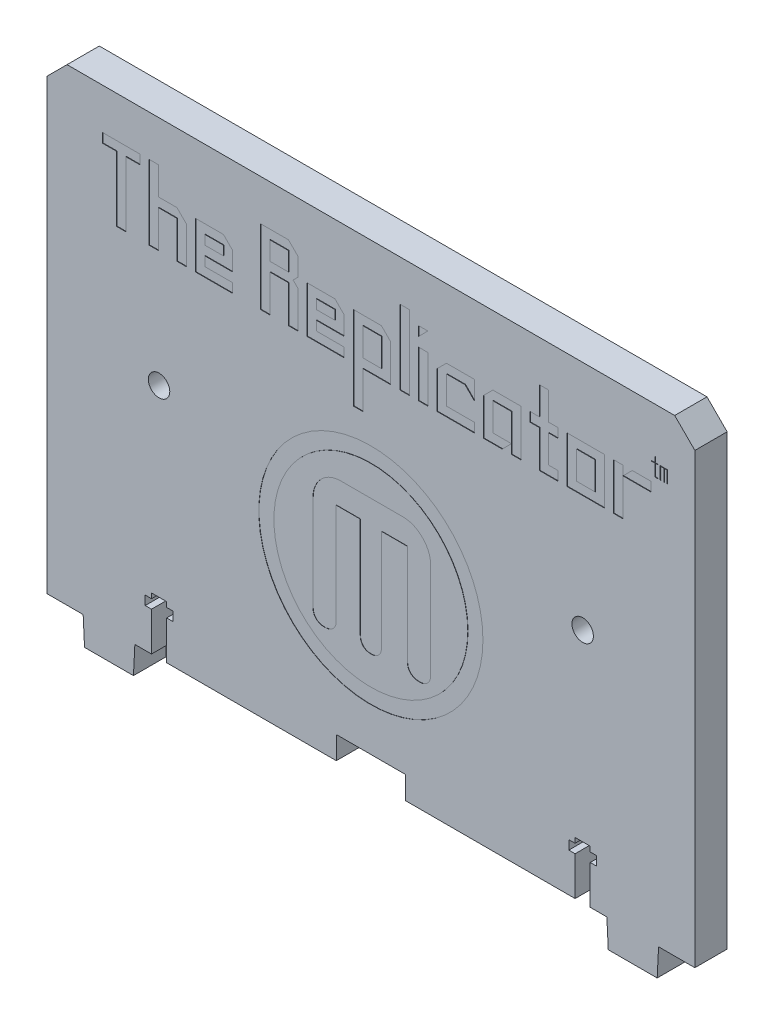
from build123d import *

# Parameters (mm, degrees)
SKETCH1_R           = 2.125
BOSS_EXTRUDE1_DEPTH = 6.4
SKETCH2_R           = 22.22577486
SKETCH2_R_2         = 19.22577486
CUT_EXTRUDE1_DEPTH  = 0.05
SKETCH3_W           = 3.685081967
SKETCH3_H           = 3.685081967
SKETCH3_W_2         = 1.842540983
SKETCH3_H_2         = 14.740327869
SKETCH3_H_3         = 9.212704918
SKETCH3_H_4         = 1.842540983
CUT_EXTRUDE5_DEPTH  = 0.1


with BuildPart() as part:
    # Sketch1 → Boss-Extrude1 (new body)
    with BuildSketch(Plane.XY):
        Polygon((-37.233636091, 42.215289676), (-37.233636091, -46.624716164), (-30.033636091, -46.624716164), (-29.758636091, -52.124716164), (-20.058636091, -52.124716164), (-19.783636091, -46.624716164), (-16.483636091, -46.624716164), (-16.483636091, -38.924710324), (-17.733636091, -38.924710324), (-17.733636091, -37.124710324), (-16.483636091, -37.124710324), (-16.483636091, -36.124710324), (-13.482276918, -36.124710324), (-13.482276918, -37.124710324), (-12.233636091, -37.124710324), (-12.233636091, -38.924710324), (-13.482276918, -38.924710324), (-13.482276918, -46.624716164), (20.166363909, -46.624716164), (20.166363909, -42.124716164), (33.866363909, -42.124716164), (33.866363909, -46.624716164), (67.515004735, -46.624716164), (67.515004735, -38.924716164), (66.266363909, -38.924716164), (66.266363909, -37.124716164), (67.515004735, -37.124716164), (67.515004735, -36.124716164), (70.516363909, -36.124716164), (70.516363909, -37.124716164), (71.766363909, -37.124716164), (71.766363909, -38.924716164), (70.516363909, -38.924716164), (70.516363909, -46.624716164), (73.816363909, -46.624716164), (74.091363909, -52.124716164), (83.791363909, -52.124716164), (84.066363909, -46.624716164), (91.266363909, -46.624716164), (91.266363909, 42.215289676), (87.266363909, 46.215289676), (-33.233636091, 46.215289676), align=None)
        with Locations((-14.982956505, 0.241643009)):
            Circle(SKETCH1_R, mode=Mode.SUBTRACT)
        with Locations(Location((69.015684322, 0.241643009, 0), (0, 0, 180))):
            Circle(SKETCH1_R, mode=Mode.SUBTRACT)
    extrude(amount=BOSS_EXTRUDE1_DEPTH)

    # Sketch2 → Cut-Extrude1 (cut)
    # profile 1 of 2: a face of its own
    with BuildSketch(Plane.XY.offset(6.4)):
        with Locations((27.013633167, -11.34725639)):
            Circle(SKETCH2_R)
        with Locations((27.013633167, -11.34725639)):
            Circle(SKETCH2_R_2, mode=Mode.SUBTRACT)
    # profile 2 of 2: a face of its own
    with BuildSketch(Plane.XY.offset(6.4)):
        with BuildLine():
            add(Edge.make_bspline(
                [(24.898597269, -22.599993337), (24.912618116, -22.893168372), (24.930798797, -23.188850856), (25.058219598, -23.606402367), (25.117244847, -23.742605904), (25.258610979, -23.997579784), (25.339711393, -24.118352097), (25.631970927, -24.449112376), (25.884659311, -24.61566059), (26.292865327, -24.770033333), (26.436296205, -24.805382018), (26.727468183, -24.844445565), (26.874272418, -24.850576033), (27.021065498, -24.856829202)],
                knots=[0, 0, 0, 0, 0.25, 0.25, 0.375, 0.375, 0.5, 0.5, 0.75, 0.75, 0.875, 0.875, 1, 1, 1, 1], degree=3))
            add(Edge.make_bspline(
                [(27.021065498, -24.856829202), (27.167969367, -24.850601654), (27.314884577, -24.844518355), (27.606580479, -24.805202296), (27.748626116, -24.769897293), (28.157512678, -24.616069014), (28.404680045, -24.446385281), (28.796431058, -24.00802027), (28.94102868, -23.746397751), (29.068268786, -23.329035533), (29.096467545, -23.183826386), (29.129610604, -22.8928638), (29.136461267, -22.746450594), (29.143430302, -22.600048736)],
                knots=[0, 0, 0, 0, 0.125, 0.125, 0.25, 0.25, 0.5, 0.5, 0.75, 0.75, 0.875, 0.875, 1, 1, 1, 1], degree=3))
            Line((29.143430302, -22.600048736), (29.143430302, -2.754053281))
            Line((29.143430302, -2.754053281), (34.264370542, -2.754053281))
            Line((34.264370542, -2.754053281), (34.264370542, -22.603127029))
            add(Edge.make_bspline(
                [(34.264370542, -22.603127029), (34.269826179, -22.757824895), (34.274576076, -22.912998736), (34.318748855, -23.219270225), (34.361248068, -23.366112195), (34.471110792, -23.652129862), (34.538368921, -23.792611975), (34.706173271, -24.046134872), (34.80740239, -24.161157336), (35.147452885, -24.474358508), (35.41769511, -24.633152257), (35.85175989, -24.775627316), (36.003428928, -24.807909013), (36.308380971, -24.844166273), (36.461941889, -24.85050425), (36.615500426, -24.856868116)],
                knots=[0, 0, 0, 0, 0.125, 0.125, 0.25, 0.25, 0.375, 0.375, 0.5, 0.5, 0.75, 0.75, 0.875, 0.875, 1, 1, 1, 1], degree=3))
            add(Edge.make_bspline(
                [(36.615500426, -24.856868116), (36.767002946, -24.850843697), (36.918879842, -24.844941869), (37.219259792, -24.805414421), (37.364771423, -24.769779987), (37.646326666, -24.666392037), (37.78338066, -24.597684993), (38.034751242, -24.434251669), (38.150667914, -24.339095246), (38.470878959, -24.015737597), (38.632804631, -23.753825812), (38.790500191, -23.332794914), (38.830475393, -23.18571394), (38.872361291, -22.886518645), (38.877821697, -22.735448747), (38.883834506, -22.584431377)],
                knots=[0, 0, 0, 0, 0.125, 0.125, 0.25, 0.25, 0.375, 0.375, 0.5, 0.5, 0.75, 0.75, 0.875, 0.875, 1, 1, 1, 1], degree=3))
            Line((38.883834506, -22.584431377), (38.883834506, -3.764709369))
            add(Edge.make_bspline(
                [(38.883834506, -3.764709369), (38.8784273, -3.578216222), (38.873112081, -3.391718501), (38.843883721, -3.019647721), (38.819373478, -2.835335429), (38.717342808, -2.291657346), (38.612899106, -1.939290527), (38.33251923, -1.254352439), (38.156862762, -0.92285707), (37.738406935, -0.318629822), (37.500526055, -0.03658407), (36.976481483, 0.491121906), (36.695028686, 0.73142933), (36.082641378, 1.152083071), (35.755711269, 1.326575091), (35.076571455, 1.603655504), (34.718329616, 1.7068022), (33.988597151, 1.837260408), (33.618652429, 1.854818533), (33.247965607, 1.865410683)],
                knots=[0, 0, 0, 0, 0.0625, 0.0625, 0.125, 0.125, 0.25, 0.25, 0.375, 0.375, 0.5, 0.5, 0.625, 0.625, 0.75, 0.75, 0.875, 0.875, 1, 1, 1, 1], degree=3))
            Line((33.247965607, 1.865410683), (21.168664354, 1.865410683))
            add(Edge.make_bspline(
                [(21.168664354, 1.865410683), (20.982195167, 1.860103743), (20.7957219, 1.854872369), (20.423717657, 1.826960935), (20.238467109, 1.803440831), (19.692779717, 1.705541418), (19.340071125, 1.601847617), (18.655721072, 1.321415046), (18.323535817, 1.146041073), (17.718749966, 0.728262121), (17.43827968, 0.489487275), (16.914407634, -0.038594958), (16.675083117, -0.321964919), (16.252892734, -0.934093757), (16.080968003, -1.261349182), (15.803810946, -1.939923401), (15.697889628, -2.296644836), (15.596130098, -2.842831405), (15.572128391, -3.025972905), (15.543491846, -3.394363443), (15.538192815, -3.579540203), (15.532823996, -3.764709369)],
                knots=[0, 0, 0, 0, 0.0625, 0.0625, 0.125, 0.125, 0.25, 0.25, 0.375, 0.375, 0.5, 0.5, 0.625, 0.625, 0.75, 0.75, 0.875, 0.875, 0.9375, 0.9375, 1, 1, 1, 1], degree=3))
            Line((15.532823996, -3.764709369), (15.532823996, -22.585267145))
            add(Edge.make_bspline(
                [(15.532823996, -22.585267145), (15.538377488, -22.737568508), (15.543410883, -22.890264437), (15.583724013, -23.192214396), (15.622237591, -23.337870248), (15.723938899, -23.622032367), (15.786335088, -23.762198894), (15.942572277, -24.017953727), (16.037607343, -24.134063811), (16.253757105, -24.348134764), (16.371490543, -24.442690553), (16.629843038, -24.602231944), (16.767319564, -24.665770141), (17.050119253, -24.7675129), (17.198162286, -24.805380463), (17.498131816, -24.845471913), (17.649479539, -24.85107548), (17.80080807, -24.856882401)],
                knots=[0, 0, 0, 0, 0.125, 0.125, 0.25, 0.25, 0.375, 0.375, 0.5, 0.5, 0.625, 0.625, 0.75, 0.75, 0.875, 0.875, 1, 1, 1, 1], degree=3))
            add(Edge.make_bspline(
                [(17.80080807, -24.856882401), (17.954548684, -24.850509908), (18.108292359, -24.844170523), (18.413595428, -24.807855837), (18.565469291, -24.775516228), (19.000055914, -24.632666045), (19.270904108, -24.47403323), (19.723827816, -24.054593293), (19.898125997, -23.794182578), (20.060796569, -23.365369448), (20.099001522, -23.217477502), (20.140580944, -22.910921214), (20.146183434, -22.756435974), (20.15228796, -22.602059665)],
                knots=[0, 0, 0, 0, 0.125, 0.125, 0.25, 0.25, 0.5, 0.5, 0.75, 0.75, 0.875, 0.875, 1, 1, 1, 1], degree=3))
            Line((20.15228796, -22.602059665), (20.15228796, -2.754053281))
            Line((20.15228796, -2.754053281), (24.898597269, -2.754053281))
            Line((24.898597269, -2.754053281), (24.898597269, -22.599993337))
        make_face()
    extrude(amount=-CUT_EXTRUDE1_DEPTH, mode=Mode.SUBTRACT)

    # Sketch3 → Cut-Extrude5 (cut)
    # profile 1 of 17: a face of its own
    with BuildSketch(Plane.XY.offset(6.4)):
        Polygon((83.439607863, 36.201077972), (83.439607863, 37.267604529), (83.312167863, 37.267604529), (83.312167863, 36.201077972), (82.715184584, 36.201077972), (82.715184584, 36.073637972), (83.312167863, 36.073637972), (83.312167863, 33.685704857), (83.909151142, 33.685704857), (83.909151142, 33.813144857), (83.439607863, 33.813144857), (83.439607863, 36.073637972), (83.909151142, 36.073637972), (83.909151142, 36.201077972), align=None)
    # profile 2 of 17: a face of its own
    with BuildSketch(Plane.XY.offset(6.4)):
        Polygon((84.37869442, 36.201077972), (84.37869442, 33.685704857), (84.50613442, 33.685704857), (84.50613442, 36.073637972), (85.103117699, 36.073637972), (85.103117699, 33.685704857), (85.230557699, 33.685704857), (85.230557699, 36.073637972), (85.700100978, 36.073637972), (85.700100978, 33.685704857), (85.827540978, 33.685704857), (85.827540978, 36.201077972), (85.103117699, 36.201077972), align=None)
    # profile 3 of 17: a face of its own
    with BuildSketch(Plane.XY.offset(6.4)):
        Polygon((49.372743169, 23.347301361), (53.057825136, 23.347301361), (54.90036612, 25.188127455), (54.90036612, 23.347301361), (56.742907103, 23.347301361), (56.742907103, 30.717465295), (56.742907103, 32.560006279), (51.215284153, 32.560006279), (49.372743169, 30.717465295), (49.372743169, 28.874924312), (49.372743169, 27.032383328), align=None)
        Polygon((52.294619672, 25.189842344), (51.215284153, 25.189842344), (51.215284153, 28.874924312), (51.215284153, 30.717465295), (54.90036612, 30.717465295), (54.90036612, 28.874924312), (54.90036612, 25.189842344), align=None, mode=Mode.SUBTRACT)
    # profile 4 of 17: a face of its own
    with BuildSketch(Plane.XY.offset(6.4)):
        Polygon((82.538480874, 32.560006279), (78.853398907, 32.560006279), (77.010857923, 30.717678105), (82.538480874, 30.717465295), align=None)
    # profile 5 of 17: a face of its own
    with BuildSketch(Plane.XY.offset(6.4)):
        Polygon((77.010857923, 23.347301361), (77.010857923, 30.717678105), (77.010857923, 32.560006279), (75.16831694, 32.560006279), (75.16831694, 23.347301361), align=None)
    # profile 6 of 17: a face of its own
    with BuildSketch(Plane.XY.offset(6.4)):
        Polygon((10.679382513, 38.08762923), (5.151759562, 38.08762923), (5.151759562, 23.347301361), (6.994300546, 23.347301361), (6.994300546, 30.717465295), (10.679382513, 30.717465295), (10.679382513, 23.347301361), (12.521923497, 23.347301361), (12.521923497, 30.717465295), (11.600653005, 31.638735787), (12.521923497, 32.560006279), (12.521923497, 36.245088246), align=None)
        with Locations((8.83684153, 34.402547263)):
            Rectangle(SKETCH3_W, SKETCH3_H, mode=Mode.SUBTRACT)
    # profile 7 of 17: a face of its own
    with BuildSketch(Plane.XY.offset(6.4)):
        Polygon((23.577169399, 32.560006279), (23.577169399, 30.717465295), (23.577169399, 15.977137426), (25.419710382, 15.977137426), (25.419710382, 23.347301361), (30.947333333, 23.347301361), (30.947333333, 28.874924312), (30.947333333, 30.717465295), (29.104792349, 32.560006279), align=None)
        Polygon((25.419710382, 25.189842344), (25.419710382, 28.874924312), (25.419710382, 30.717465295), (29.104792349, 30.717465295), (29.104792349, 28.874924312), (29.104792349, 25.189842344), (27.262251366, 25.189842344), align=None, mode=Mode.SUBTRACT)
    # profile 8 of 17: a face of its own
    with BuildSketch(Plane.XY.offset(6.4)):
        with Locations((33.711144809, 30.717465296)):
            Rectangle(SKETCH3_W_2, SKETCH3_H_2)
    # profile 9 of 17: a face of its own
    with BuildSketch(Plane.XY.offset(6.4)):
        with Locations((37.396226775, 27.95365382)):
            Rectangle(SKETCH3_W_2, SKETCH3_H_3)
    # profile 10 of 17: a face of its own
    with BuildSketch(Plane.XY.offset(6.4)):
        Polygon((40.160038251, 30.717465295), (40.160038251, 23.347301361), (47.530202185, 23.347301361), (47.530202185, 25.189842344), (42.002579235, 25.189842344), (42.002579235, 30.717465295), (45.687661202, 30.717465295), (47.530202185, 28.874924312), (47.530202185, 32.560006279), (42.002579235, 32.560006279), align=None)
    # profile 11 of 17: a face of its own
    with BuildSketch(Plane.XY.offset(6.4)):
        Polygon((60.427989071, 30.717465295), (60.427989071, 23.347301361), (62.270530054, 23.347301361), (64.113071038, 23.347301361), (64.113071038, 25.189842344), (62.270530054, 25.189842344), (62.270530054, 30.717465295), (64.113071038, 30.717465295), (64.113071038, 32.560006279), (62.270530054, 32.560006279), (62.270530054, 38.08762923), (60.427989071, 38.08762923), (60.427989071, 32.560006279), (58.585448087, 32.560006279), (58.585448087, 30.717465295), align=None)
    # profile 12 of 17: a face of its own
    with BuildSketch(Plane.XY.offset(6.4)):
        Polygon((65.955612021, 32.560006279), (65.955612021, 30.717465295), (65.955612021, 23.347301361), (73.325775956, 23.347301361), (73.325775956, 30.717465295), (73.325775956, 32.560006279), align=None)
        Polygon((71.483234972, 25.189842344), (67.798153005, 25.189842344), (67.798153005, 28.874924312), (67.798153005, 30.717465295), (71.483234972, 30.717465295), (71.483234972, 28.874924312), align=None, mode=Mode.SUBTRACT)
    # profile 13 of 17: a face of its own
    with BuildSketch(Plane.XY.offset(6.4)):
        Polygon((16.207005464, 27.032383328), (21.734628415, 27.032383328), (21.734628415, 30.717465295), (19.892087431, 32.560006279), (14.364464481, 32.560006279), (14.364464481, 25.189842344), (14.364464481, 23.347301361), (16.207005464, 23.347301361), (19.892087431, 23.347301361), (21.734628415, 23.347301361), (21.734628415, 25.189842344), (16.207005464, 25.189842344), align=None)
        Polygon((19.892087431, 28.874924312), (18.049546448, 28.874924312), (16.207005464, 28.874924312), (16.207005464, 30.717465295), (19.892087431, 30.717465295), align=None, mode=Mode.SUBTRACT)
    # profile 14 of 17: a face of its own
    with BuildSketch(Plane.XY.offset(6.4)):
        Polygon((38.317497267, 36.245088246), (36.474956284, 36.245088246), (36.474956284, 34.402547263), align=None)
    # profile 15 of 17: a face of its own
    with BuildSketch(Plane.XY.offset(6.4)):
        Polygon((-18.801273224, 36.245088246), (-18.801273224, 38.08762923), (-26.171437159, 38.08762923), (-26.171437159, 36.245088246), (-23.407625683, 36.245088246), (-23.407625683, 23.347301361), (-21.5650847, 23.347301361), (-21.5650847, 36.245088246), align=None)
    # profile 16 of 17: a face of its own
    with BuildSketch(Plane.XY.offset(6.4)):
        Polygon((-15.116191257, 38.08762923), (-16.958732241, 38.08762923), (-16.958732241, 23.347301361), (-15.116191257, 23.347301361), (-15.116191257, 30.717465295), (-11.43110929, 30.717465295), (-11.43110929, 28.874924312), (-11.43110929, 23.347301361), (-9.588568306, 23.347301361), (-9.588568306, 28.874924312), (-9.588568306, 30.717465295), (-11.43110929, 32.560006279), (-15.116191257, 32.560006279), align=None)
    # profile 17 of 17: a face of its own
    with BuildSketch(Plane.XY.offset(6.4)):
        Polygon((-5.903486339, 27.032383328), (-0.375863388, 27.032383328), (-0.375863388, 30.717465295), (-2.218404372, 32.560006279), (-7.746027323, 32.560006279), (-7.746027323, 23.347301361), (-0.375863388, 23.347301361), (-0.375863388, 25.189842344), (-5.903486339, 25.189842344), align=None)
        with Locations((-4.060945356, 29.796194804)):
            Rectangle(SKETCH3_W, SKETCH3_H_4, mode=Mode.SUBTRACT)
    extrude(amount=-CUT_EXTRUDE5_DEPTH, mode=Mode.SUBTRACT)


solid = part.part
